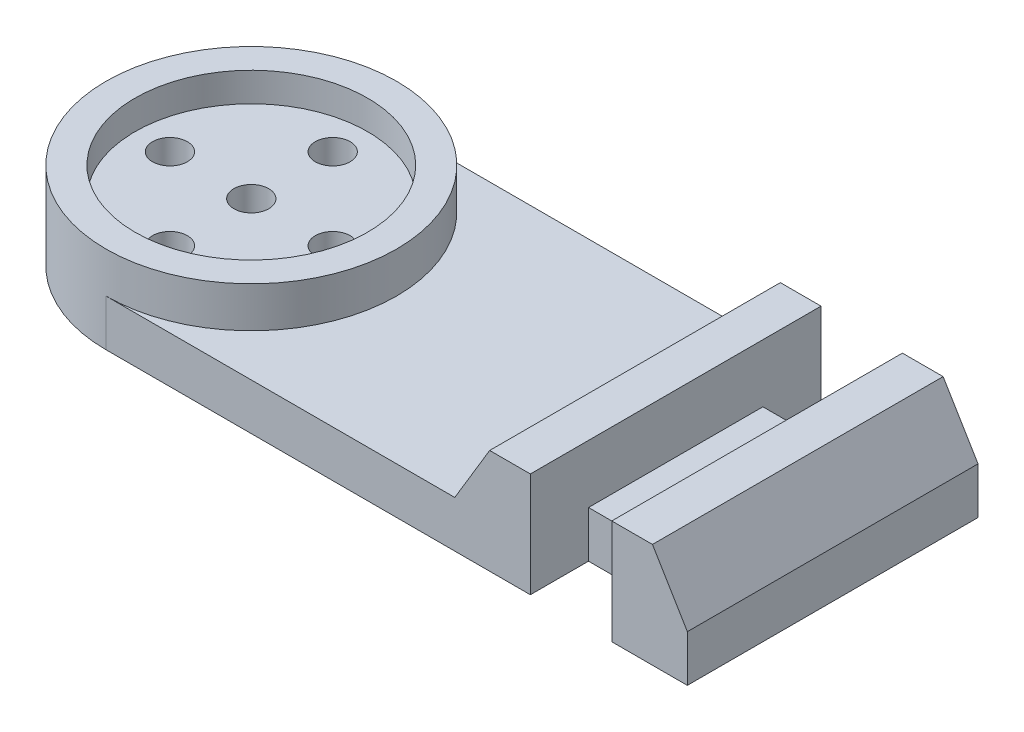
from build123d import *

# Parameters (mm, degrees)
SKETCH_1_R          = 12.5
EXTRUDE_1_DEPTH     = 4
SKETCH_2_R          = 12.5
SKETCH_2_R_2        = 10
EXTRUDE_2_DEPTH     = 3.5
SKETCH_3_R          = 1.5
CUT_EXTRUDE_1_DEPTH = 53.08166664
EXTRUDE_3_DEPTH     = 25
SKETCH_5_W          = 7
SKETCH_5_H          = 5
CUT_EXTRUDE_2_DEPTH = 57.621550668
SKETCH_6_W          = 7
SKETCH_6_H          = 5
CUT_EXTRUDE_3_DEPTH = 52.780787943
SKETCH_7_R          = 10
SKETCH_7_R_2        = 1.5
EXTRUDE_4_DEPTH     = 1


with BuildPart() as part:
    # 草图1 → 凸台-拉伸1 (new body)
    with BuildSketch(Plane(origin=(0, 0, 0), x_dir=(1, 0, 0), z_dir=(0, 1, 0))):
        Circle(SKETCH_1_R)
        with BuildLine():
            Line((50, 12.5), (0, 12.5))
            ThreePointArc((0, 12.5), (8.838834765, 8.838834765), (12.5, 0))
            ThreePointArc((12.5, 0), (8.838834765, -8.838834765), (0, -12.5))
            Line((0, -12.5), (50, -12.5))
            Line((50, -12.5), (50, 12.5))
        make_face()
    extrude(amount=EXTRUDE_1_DEPTH)

    # 草图2 → 凸台-拉伸2 (add)
    with BuildSketch(Plane(origin=(0, 4, 0), x_dir=(1, 0, 0), z_dir=(0, 1, 0))):
        with Locations(Location((0, 0, 0), (0, 0, 270))):
            Circle(SKETCH_2_R)
        with Locations(Location((0, 0, 0), (0, 0, 270))):
            Circle(SKETCH_2_R_2, mode=Mode.SUBTRACT)
    extrude(amount=EXTRUDE_2_DEPTH)

    # 草图3 → 切除-拉伸1 (cut, through all)
    with BuildSketch(Plane.XZ):
        with Locations(Location((0, 0, 0), (0, 0, 270))):
            Circle(SKETCH_3_R)
        with Locations(Location((0, 7, 0), (0, 0, 270))):
            Circle(SKETCH_3_R)
        with Locations(Location((7, 0, 0), (0, 0, 270))):
            Circle(SKETCH_3_R)
        with Locations(Location((0, -7, 0), (0, 0, 270))):
            Circle(SKETCH_3_R)
        with Locations(Location((-7, 0, 0), (0, 0, 270))):
            Circle(SKETCH_3_R)
        with Locations(Location((40, 0, 0), (0, 0, 270))):
            Circle(SKETCH_3_R)
    extrude(amount=-CUT_EXTRUDE_1_DEPTH, mode=Mode.SUBTRACT)

    # 草图4 → 凸台-拉伸3 (add)
    with BuildSketch(Plane.XY.offset(12.5)):
        Polygon((50, 4), (47, 9), (33, 9), (30, 4), align=None)
    extrude(amount=-EXTRUDE_3_DEPTH)

    # 草图5 → 切除-拉伸2 (cut, through all)
    with BuildSketch(Plane.XY.offset(12.5)):
        with Locations((40, 6.5)):
            Rectangle(SKETCH_5_W, SKETCH_5_H)
    extrude(amount=-CUT_EXTRUDE_2_DEPTH, mode=Mode.SUBTRACT)

    # 草图6 → 切除-拉伸3 (cut, through all)
    with BuildSketch(Plane(origin=(0, 4, 0), x_dir=(1, 0, 0), z_dir=(0, 1, 0))):
        with Locations((40, -10)):
            Rectangle(SKETCH_6_W, SKETCH_6_H)
        with Locations((40, 10)):
            Rectangle(SKETCH_6_W, SKETCH_6_H)
    extrude(amount=-CUT_EXTRUDE_3_DEPTH, mode=Mode.SUBTRACT)

    # 草图7 → 凸台-拉伸4 (add)
    with BuildSketch(Plane(origin=(0, 4, 0), x_dir=(1, 0, 0), z_dir=(0, 1, 0))):
        with Locations(Location((0, 0, 0), (0, 0, 270))):
            Circle(SKETCH_7_R)
        with Locations(Location((0, 0, 0), (0, 0, 90))):
            Circle(SKETCH_7_R_2, mode=Mode.SUBTRACT)
        with Locations(Location((0, 7, 0), (0, 0, 90))):
            Circle(SKETCH_7_R_2, mode=Mode.SUBTRACT)
        with Locations(Location((7, 0, 0), (0, 0, 90))):
            Circle(SKETCH_7_R_2, mode=Mode.SUBTRACT)
        with Locations(Location((0, -7, 0), (0, 0, 90))):
            Circle(SKETCH_7_R_2, mode=Mode.SUBTRACT)
        with Locations(Location((-7, 0, 0), (0, 0, 90))):
            Circle(SKETCH_7_R_2, mode=Mode.SUBTRACT)
    extrude(amount=EXTRUDE_4_DEPTH)


solid = part.part
